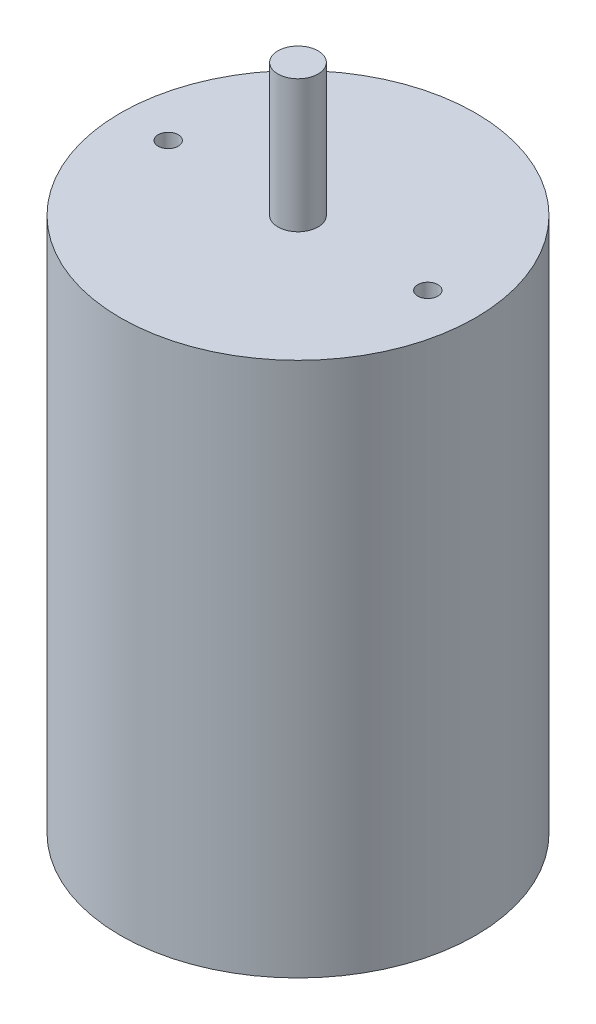
from build123d import *

# Parameters (mm, degrees)
SKETCH_1_R          = 22.1
EXTRUDE_1_DEPTH     = 66.6
SKETCH_2_R          = 2.5
EXTRUDE_2_DEPTH     = 16.5
EXTRUDE_START       = 5
SKETCH_3_R          = 2.5
EXTRUDE_3_DEPTH     = 5
SKETCH_4_R          = 1.25
CUT_EXTRUDE_1_DEPTH = 5


with BuildPart() as part:
    # 草圖1 → 填料-伸長1 (new body)
    with BuildSketch(Plane(origin=(0, 0, 0), x_dir=(1, 0, 0), z_dir=(0, 1, 0))):
        with Locations(Location((0, 0, 0), (0, 0, 270))):
            Circle(SKETCH_1_R)
    extrude(amount=EXTRUDE_1_DEPTH)

    # 草圖2 → 填料-伸長2 (add)
    with BuildSketch(Plane(origin=(0, 66.6, 0), x_dir=(1, 0, 0), z_dir=(0, 1, 0))):
        with Locations(Location((0, 0, 0), (0, 0, 270))):
            Circle(SKETCH_2_R)
    extrude(amount=EXTRUDE_2_DEPTH)

    # 草圖3 → 填料-伸長3 (add)
    with BuildSketch(Plane.XZ.offset(EXTRUDE_START)):
        with Locations(Location((0, 0, 0), (0, 0, 90))):
            Circle(SKETCH_3_R)
    extrude(amount=-EXTRUDE_3_DEPTH)

    # 草圖4 → 除料-伸長1 (cut)
    with BuildSketch(Plane(origin=(0, 66.6, 0), x_dir=(1, 0, 0), z_dir=(0, 1, 0))):
        with Locations(Location((-16.165, 0, 0), (0, 0, 270))):
            Circle(SKETCH_4_R)
        with Locations(Location((16.165, 0, 0), (0, 0, 270))):
            Circle(SKETCH_4_R)
    extrude(amount=-CUT_EXTRUDE_1_DEPTH, mode=Mode.SUBTRACT)


solid = part.part
